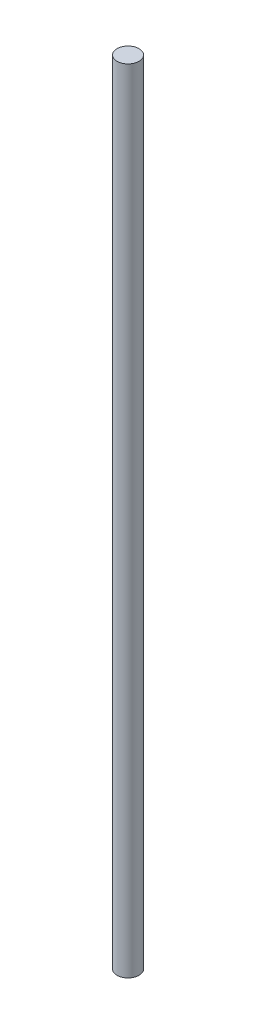
from build123d import *

# Parameters (mm, degrees)
SKETCH_1_R      = 5
EXTRUDE_1_DEPTH = 360


with BuildPart() as part:
    # 스케치1 → 보스-돌출1 (new body)
    with BuildSketch(Plane(origin=(0, 0, 0), x_dir=(1, 0, 0), z_dir=(0, 1, 0))):
        with Locations(Location((0, 0, 0), (0, 0, 90))):
            Circle(SKETCH_1_R)
    extrude(amount=EXTRUDE_1_DEPTH)


solid = part.part
